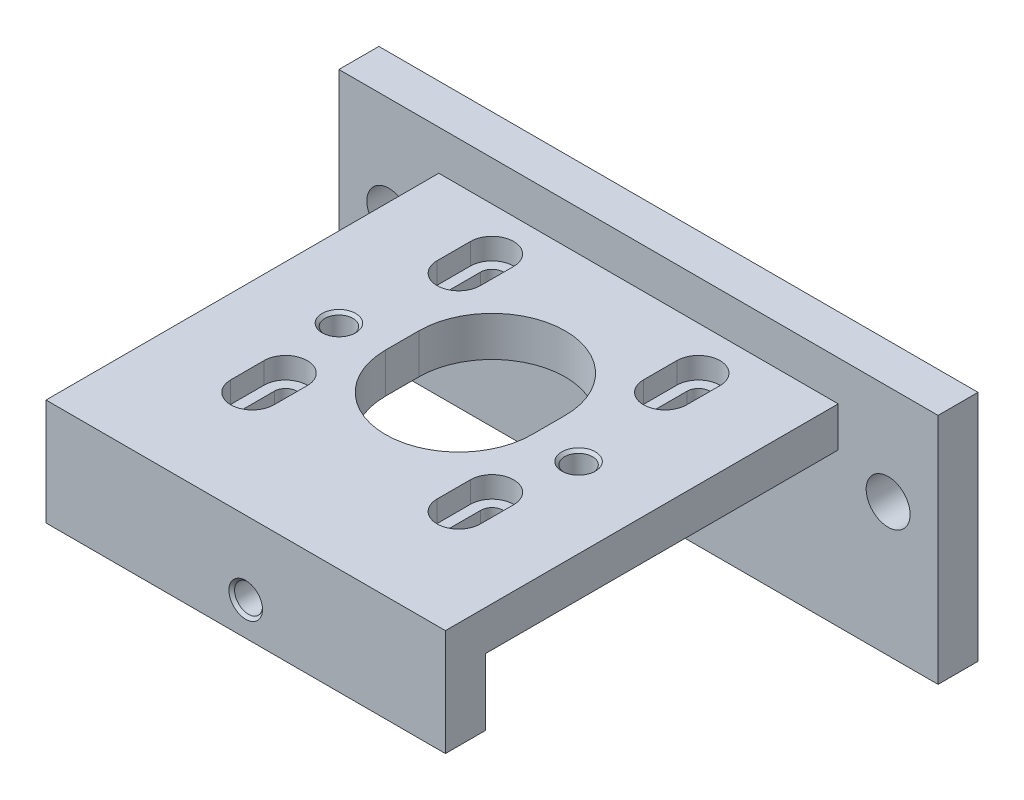
from build123d import *

# Parameters (mm, degrees)
BOSS_EXTRUDE1_DEPTH                                 = 90
SKETCH3_W                                           = 15
SKETCH3_H                                           = 59
CUT_EXTRUDE1_DEPTH                                  = 111.381157812
M6_CLEARANCE_HOLE1_D                                = 6.6
M5_TAPPED_HOLE1_D                                   = 4.2
M5_TAPPED_HOLE1_DEPTH                               = 6
M5_TAPPED_HOLE1_CSINK_D                             = 5.05
M5_TAPPED_HOLE1_CSINK_ANGLE                         = 90
CUT_EXTRUDE2_DEPTH                                  = 112.986606342
M5_TAPPED_HOLE2_D                                   = 4.2
M5_TAPPED_HOLE2_CSINK_D                             = 5.05
M5_TAPPED_HOLE2_CSINK_ANGLE                         = 90
CBORE_FOR_M3_HEX_SOCKET_HEAD_CAP_SCREW1_D           = 3.4
CBORE_FOR_M3_HEX_SOCKET_HEAD_CAP_SCREW1_CBORE_D     = 6.5
CBORE_FOR_M3_HEX_SOCKET_HEAD_CAP_SCREW1_CBORE_DEPTH = 3
CUT_EXTRUDE3_DEPTH                                  = 112.986606342
CUT_EXTRUDE4_DEPTH                                  = 3.2


with BuildPart() as part:
    # Sketch1 → Boss-Extrude1 (new body)
    with BuildSketch(Plane(origin=(0, 0, 0), x_dir=(0, 0, -1), z_dir=(1, 0, 0))):
        Polygon((-60, 0), (-60, -16), (-54, -16), (-54, -6), (-1, -6), (-1, -29), (5, -29), (5, 6), (-1, 6), (-1, 0), align=None)
    extrude(amount=BOSS_EXTRUDE1_DEPTH)

    # Sketch3 → Cut-Extrude1 (cut, through all)
    with BuildSketch(Plane.XZ.offset(16)):
        with Locations((82.5, 30.5)):
            Rectangle(SKETCH3_W, SKETCH3_H)
        with Locations((7.5, 30.5)):
            Rectangle(SKETCH3_W, SKETCH3_H)
    extrude(amount=-CUT_EXTRUDE1_DEPTH, mode=Mode.SUBTRACT)

    # M6 Clearance Hole1 (through all)
    with Locations(Plane.XY.offset(1)):
        with Locations((7.5, -9), (82.5, -9)):
            Hole(M6_CLEARANCE_HOLE1_D / 2)

    # M5 Tapped Hole1
    with Locations(Plane.XY.offset(60)):
        with Locations((45, -11)):
            CounterSinkHole(M5_TAPPED_HOLE1_D / 2, M5_TAPPED_HOLE1_CSINK_D / 2, depth=M5_TAPPED_HOLE1_DEPTH, counter_sink_angle=M5_TAPPED_HOLE1_CSINK_ANGLE)

    # Sketch9 → Cut-Extrude2 (cut, through all)
    with BuildSketch(Plane(origin=(0, 0, 0), x_dir=(1, 0, 0), z_dir=(0, 1, 0))):
        with BuildLine():
            Line((34, -28), (34, -23))
            ThreePointArc((34, -23), (45, -12), (56, -23))
            Line((56, -23), (56, -28))
            ThreePointArc((56, -28), (45, -39), (34, -28))
        make_face()
    extrude(amount=-CUT_EXTRUDE2_DEPTH, mode=Mode.SUBTRACT)

    # M5 Tapped Hole2 (through all)
    with Locations(Plane(origin=(0, 0, 0), x_dir=(-1, 0, 0), z_dir=(0, 1, 0))):
        with Locations((-27, 28), (-63, 28)):
            CounterSinkHole(M5_TAPPED_HOLE2_D / 2, M5_TAPPED_HOLE2_CSINK_D / 2, counter_sink_angle=M5_TAPPED_HOLE2_CSINK_ANGLE)

    # CBORE for M3 Hex Socket Head Cap Screw1 (through all)
    with Locations(Plane(origin=(0, 0, 0), x_dir=(-1, 0, 0), z_dir=(0, 1, 0))):
        with Locations((-29.5, 12.5), (-60.5, 12.5), (-29.5, 43.5), (-60.5, 43.5)):
            CounterBoreHole(CBORE_FOR_M3_HEX_SOCKET_HEAD_CAP_SCREW1_D / 2, CBORE_FOR_M3_HEX_SOCKET_HEAD_CAP_SCREW1_CBORE_D / 2, CBORE_FOR_M3_HEX_SOCKET_HEAD_CAP_SCREW1_CBORE_DEPTH)

    # Sketch15 → Cut-Extrude3 (cut, through all)
    with BuildSketch(Plane(origin=(0, 0, 0), x_dir=(1, 0, 0), z_dir=(0, 1, 0))):
        with BuildLine():
            Line((27.8, -12.5), (27.8, -7.5))
            ThreePointArc((27.8, -7.5), (29.5, -5.8), (31.2, -7.5))
            Line((31.2, -7.5), (31.2, -12.5))
            ThreePointArc((31.2, -12.5), (29.5, -14.2), (27.8, -12.5))
        make_face()
        with BuildLine():
            Line((58.8, -12.5), (58.8, -7.5))
            ThreePointArc((58.8, -7.5), (60.5, -5.8), (62.2, -7.5))
            Line((62.2, -7.5), (62.2, -12.5))
            ThreePointArc((62.2, -12.5), (60.5, -14.2), (58.8, -12.5))
        make_face()
        with BuildLine():
            Line((27.8, -43.5), (27.8, -38.5))
            ThreePointArc((27.8, -38.5), (29.5, -36.8), (31.2, -38.5))
            Line((31.2, -38.5), (31.2, -43.5))
            ThreePointArc((31.2, -43.5), (29.5, -45.2), (27.8, -43.5))
        make_face()
        with BuildLine():
            Line((58.8, -43.5), (58.8, -38.5))
            ThreePointArc((58.8, -38.5), (60.5, -36.8), (62.2, -38.5))
            Line((62.2, -38.5), (62.2, -43.5))
            ThreePointArc((62.2, -43.5), (60.5, -45.2), (58.8, -43.5))
        make_face()
    extrude(amount=-CUT_EXTRUDE3_DEPTH, mode=Mode.SUBTRACT)

    # Sketch16 → Cut-Extrude4 (cut)
    with BuildSketch(Plane(origin=(0, 0, 0), x_dir=(1, 0, 0), z_dir=(0, 1, 0))):
        with BuildLine():
            Line((26.25, -12.5), (26.25, -7.5))
            ThreePointArc((26.25, -7.5), (29.5, -4.25), (32.75, -7.5))
            Line((32.75, -7.5), (32.75, -12.5))
            ThreePointArc((32.75, -12.5), (29.5, -15.75), (26.25, -12.5))
        make_face()
        with BuildLine():
            Line((57.25, -12.5), (57.25, -7.5))
            ThreePointArc((57.25, -7.5), (60.5, -4.25), (63.75, -7.5))
            Line((63.75, -7.5), (63.75, -12.5))
            ThreePointArc((63.75, -12.5), (60.5, -15.75), (57.25, -12.5))
        make_face()
        with BuildLine():
            Line((26.25, -43.5), (26.25, -38.5))
            ThreePointArc((26.25, -38.5), (29.5, -35.25), (32.75, -38.5))
            Line((32.75, -38.5), (32.75, -43.5))
            ThreePointArc((32.75, -43.5), (29.5, -46.75), (26.25, -43.5))
        make_face()
        with BuildLine():
            Line((57.25, -43.5), (57.25, -38.5))
            ThreePointArc((57.25, -38.5), (60.5, -35.25), (63.75, -38.5))
            Line((63.75, -38.5), (63.75, -43.5))
            ThreePointArc((63.75, -43.5), (60.5, -46.75), (57.25, -43.5))
        make_face()
    extrude(amount=-CUT_EXTRUDE4_DEPTH, mode=Mode.SUBTRACT)


solid = part.part
